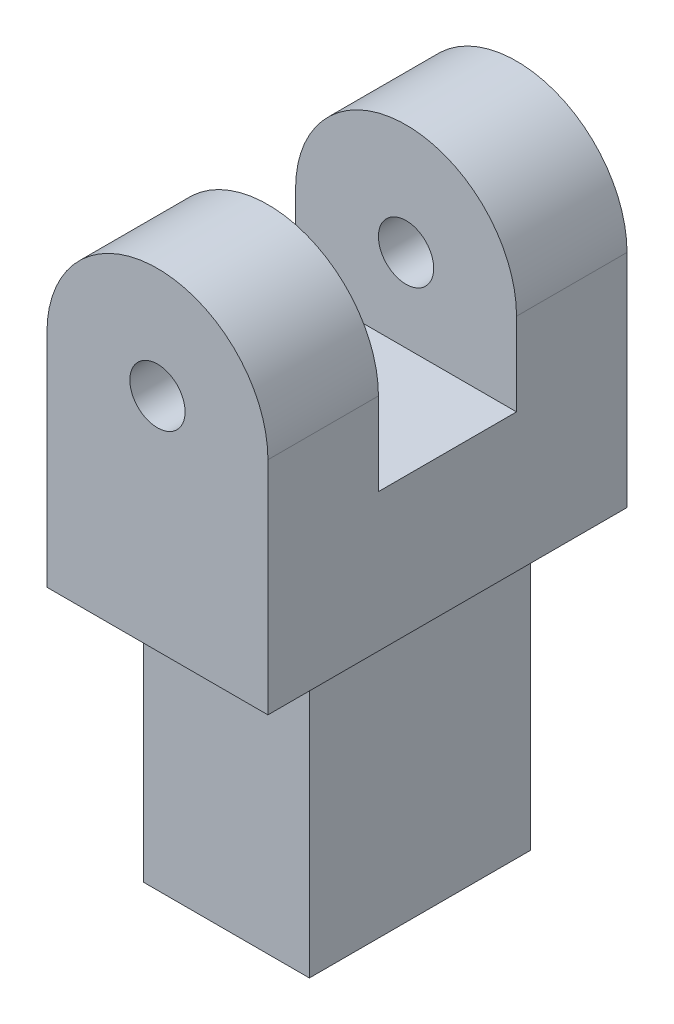
from build123d import *

# Parameters (mm, degrees)
SKETCH1_W           = 8
SKETCH1_H           = 13
BOSS_EXTRUDE1_DEPTH = 12
SKETCH2_W           = 13
SKETCH2_H           = 5
CUT_EXTRUDE1_DEPTH  = 7
SKETCH3_R           = 1
CUT_EXTRUDE2_DEPTH  = 19.138357147
CUT_EXTRUDE3_START  = -13
CUT_EXTRUDE3_DEPTH  = 32.138357147
SKETCH6_W           = 6
SKETCH6_H           = 8
BOSS_EXTRUDE3_DEPTH = 10


with BuildPart() as part:
    # Sketch1 → Boss-Extrude1 (new body)
    with BuildSketch(Plane(origin=(0, 0, 0), x_dir=(1, 0, 0), z_dir=(0, 1, 0))):
        Rectangle(SKETCH1_W, SKETCH1_H)
    extrude(amount=BOSS_EXTRUDE1_DEPTH)

    # Sketch2 → Cut-Extrude1 (cut)
    with BuildSketch(Plane(origin=(0, 12, 0), x_dir=(1, 0, 0), z_dir=(0, 1, 0))):
        Rectangle(SKETCH2_W, SKETCH2_H)
    extrude(amount=-CUT_EXTRUDE1_DEPTH, mode=Mode.SUBTRACT)

    # Sketch3 → Cut-Extrude2 (cut, through all)
    with BuildSketch(Plane(origin=(0, 0, -6.5), x_dir=(-1, 0, 0), z_dir=(0, 0, -1))):
        with Locations((0, 8)):
            Circle(SKETCH3_R)
    extrude(amount=-CUT_EXTRUDE2_DEPTH, mode=Mode.SUBTRACT)

    # Sketch4 → Cut-Extrude3 (cut)
    with BuildSketch(Plane(origin=(0, 0, -6.5), x_dir=(-1, 0, 0), z_dir=(0, 0, -1)).offset(CUT_EXTRUDE3_START)):
        with BuildLine():
            Line((-4, -27.298221281), (-4, 8))
            ThreePointArc((-4, 8), (-2.828427125, 10.828427125), (0, 12))
            Line((0, 12), (35.298221281, 12))
            Line((35.298221281, 12), (-14.621001982, 61.919223264))
            Line((-14.621001982, 61.919223264), (-53.919223264, 22.621001982))
            Line((-53.919223264, 22.621001982), (-4, -27.298221281))
        make_face()
    cut_extrude3 = extrude(amount=CUT_EXTRUDE3_DEPTH, mode=Mode.SUBTRACT)

    # Mirror1: Cut-Extrude3 across plane
    add(cut_extrude3.mirror(Plane(origin=(0, 0, 0), x_dir=(0, 0, 1), z_dir=(1, 0, 0))), mode=Mode.SUBTRACT)

    # Sketch6 → Boss-Extrude3 (add)
    with BuildSketch(Plane.XZ):
        Rectangle(SKETCH6_W, SKETCH6_H)
    extrude(amount=BOSS_EXTRUDE3_DEPTH)


solid = part.part
